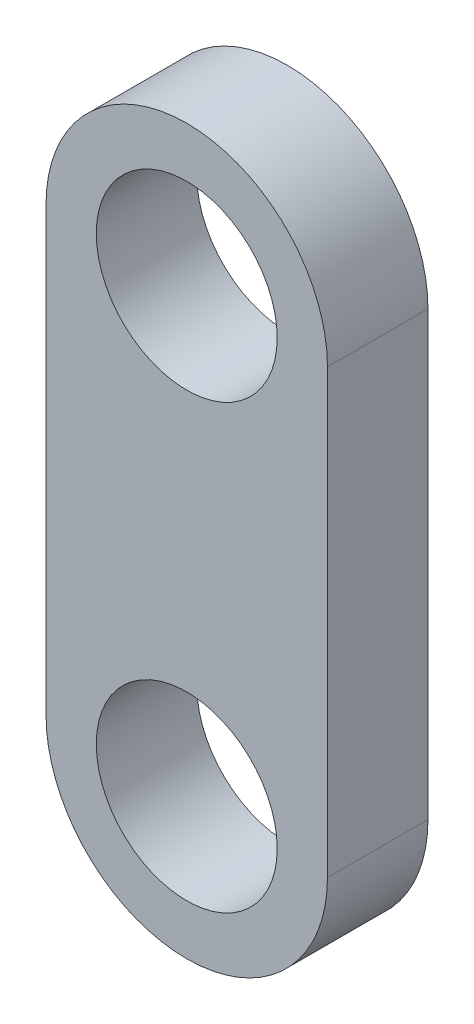
from build123d import *

# Parameters (mm, degrees)
SKETCH2_R           = 2.25
BOSS_EXTRUDE1_DEPTH = 2.5


with BuildPart() as part:
    # Sketch2 → Boss-Extrude1 (new body)
    with BuildSketch(Plane.XY):
        with BuildLine():
            Line((-3.5, 0), (-3.5, -11))
            ThreePointArc((-3.5, -11), (0, -14.5), (3.5, -11))
            Line((3.5, -11), (3.5, 0))
            ThreePointArc((3.5, 0), (0, 3.5), (-3.5, 0))
        make_face()
        Circle(SKETCH2_R, mode=Mode.SUBTRACT)
        with Locations((0, -11)):
            Circle(SKETCH2_R, mode=Mode.SUBTRACT)
    extrude(amount=BOSS_EXTRUDE1_DEPTH)


solid = part.part
